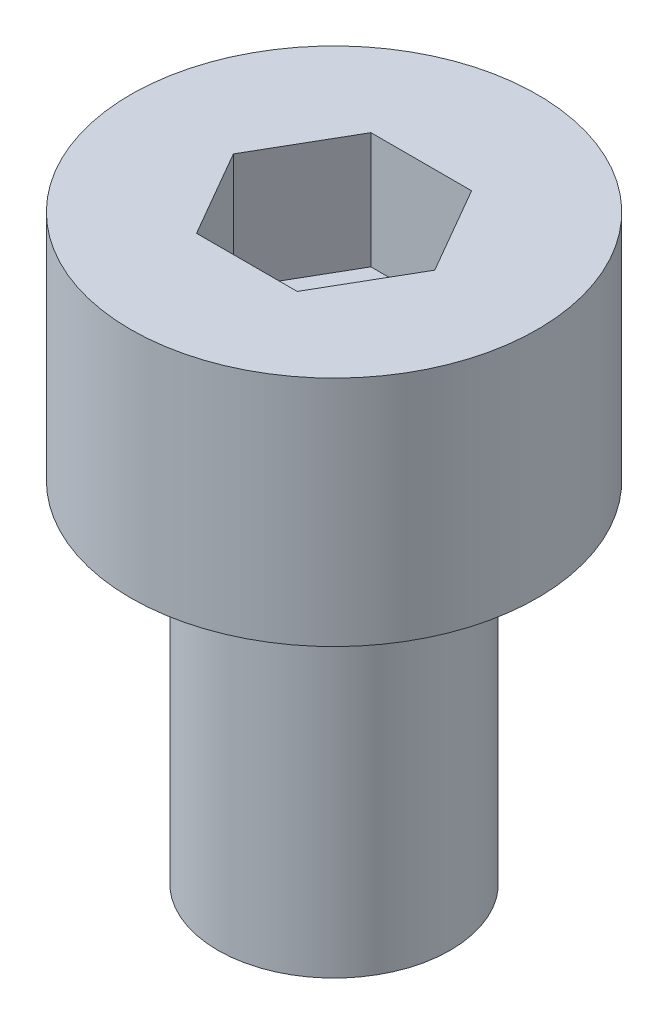
from build123d import *

# Parameters (mm, degrees)
CUT_EXTRUDE1_DEPTH = 2


with BuildPart() as part:
    # Sketch1 → Revolve1 (revolve)
    with BuildSketch(Plane.XY, mode=Mode.PRIVATE) as revolve1_sk:
        Polygon((0, -6), (2, -6), (2, 0), (3.5, 0), (3.5, 4), (0, 4), align=None)
    revolve(revolve1_sk.sketch.rotate(Axis((0, 61.691642626, 0), (0, -1, 0)), 90), axis=Axis((0, 61.691642626, 0), (0, -1, 0)))

    # Sketch2 → Cut-Extrude1 (cut)
    with BuildSketch(Plane(origin=(0, 4, 0), x_dir=(-1, 0, 0), z_dir=(0, 1, 0))):
        Polygon((-0.866025404, -1.5), (0.866025404, -1.5), (1.732050808, 0), (0.866025404, 1.5), (-0.866025404, 1.5), (-1.732050808, 0), align=None)
    extrude(amount=-CUT_EXTRUDE1_DEPTH, mode=Mode.SUBTRACT)


solid = part.part
